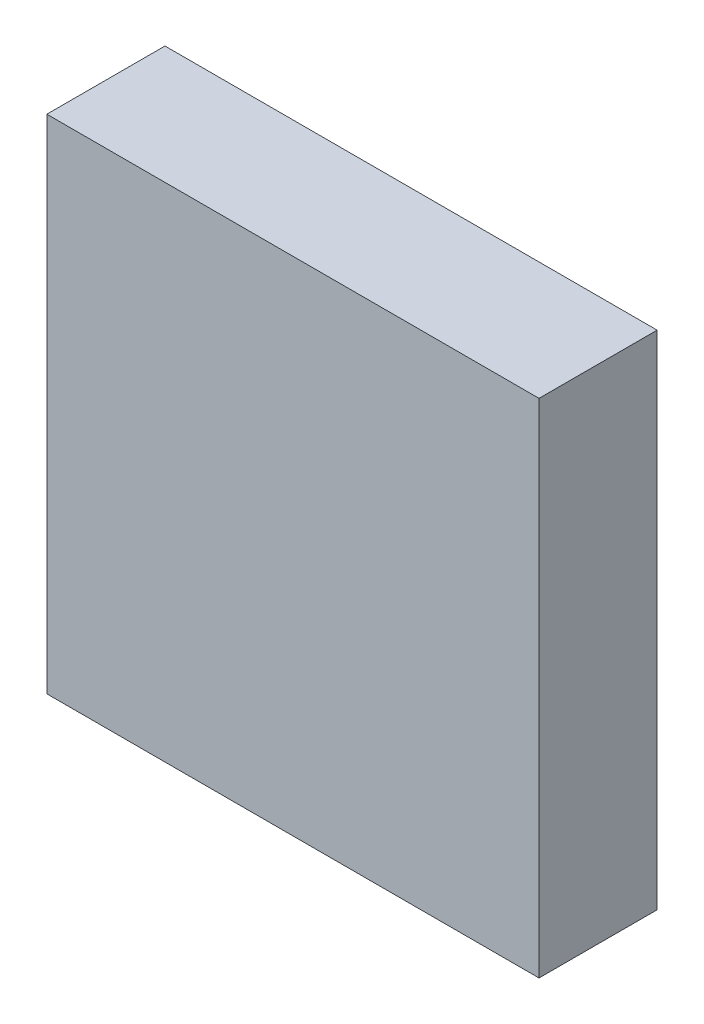
from build123d import *

# Parameters (mm, degrees)
SKETCH_1_W      = 50
SKETCH_1_H      = 51
EXTRUDE_1_DEPTH = 12


with BuildPart() as part:
    # 草图1 → 凸台-拉伸1 (new body)
    with BuildSketch(Plane.XY):
        with Locations((25, -25.5)):
            Rectangle(SKETCH_1_W, SKETCH_1_H)
    extrude(amount=EXTRUDE_1_DEPTH)


solid = part.part
